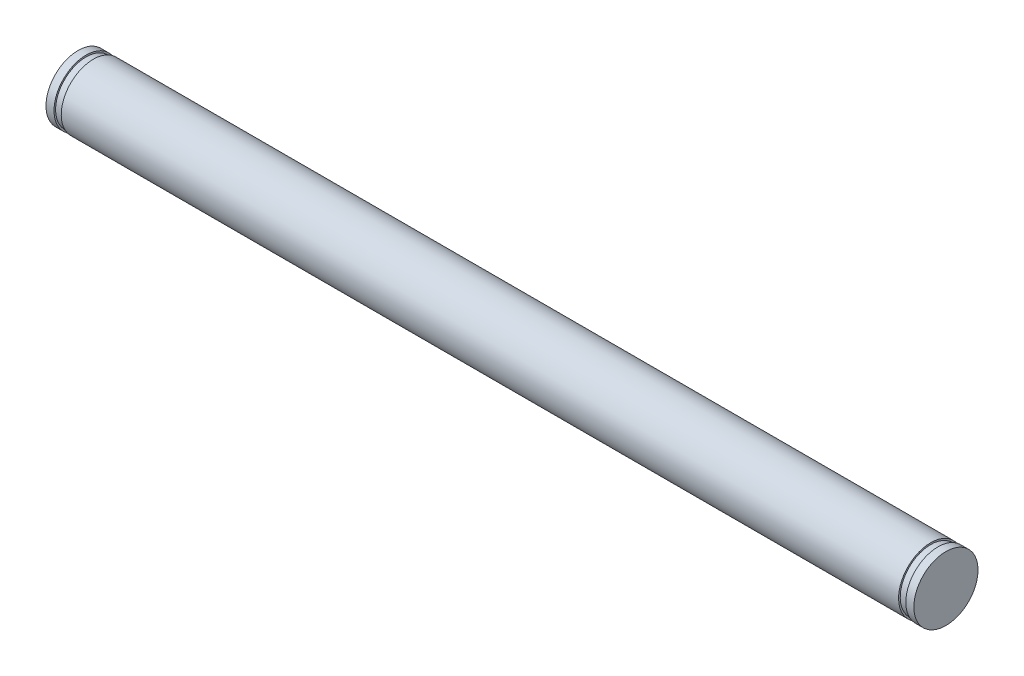
from build123d import *


with BuildPart() as part:
    # Sketch1 → Revolve1 (revolve)
    with BuildSketch(Plane.XY):
        Polygon((0, 0), (104.4, 0), (104.4, -0.2), (105.3, -0.2), (105.3, 0), (106.3, 0), (106.3, -4), (10.4, -4), (-1.9, -4), (-1.9, 0), (-0.9, 0), (-0.9, -0.2), (0, -0.2), align=None)
    revolve(axis=Axis((106.3, -4, 0), (-1, 0, 0)))


solid = part.part
